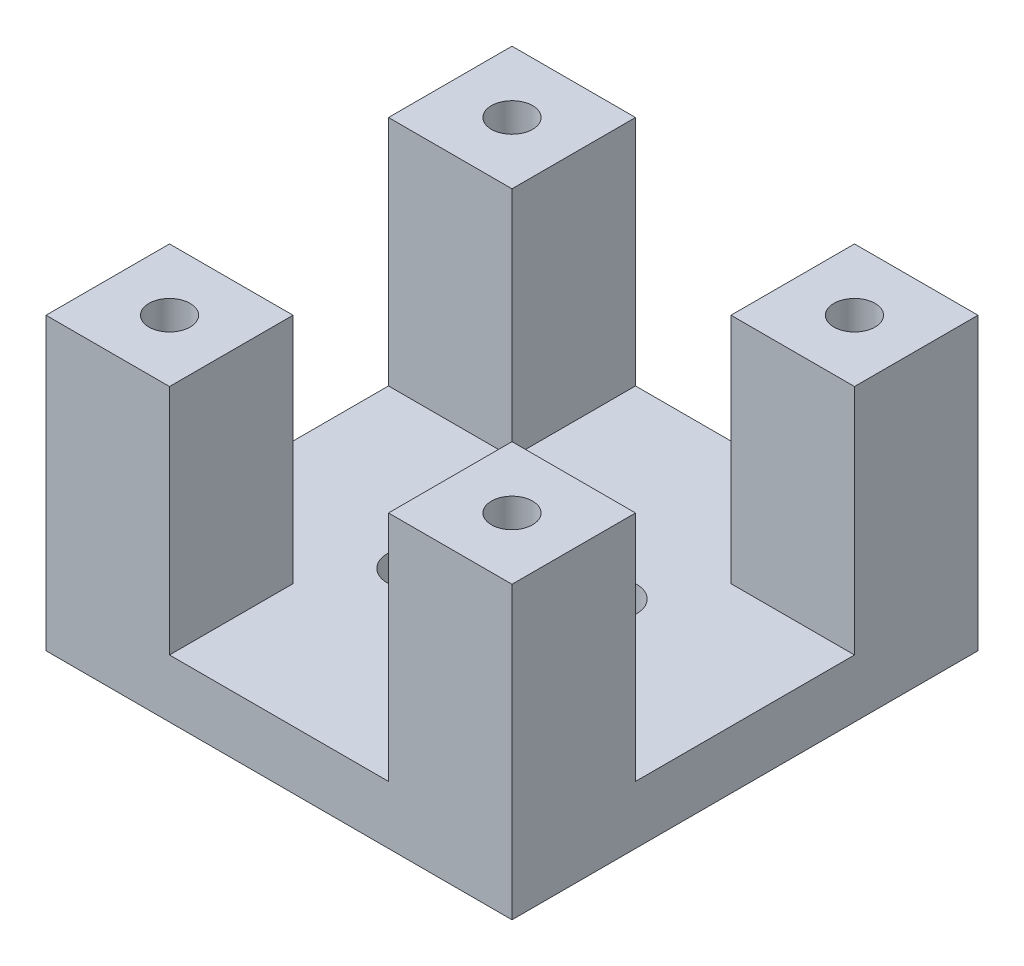
from build123d import *

# Parameters (mm, degrees)
SKETCH1_W           = 96.210678118
SKETCH1_H           = 96.210678118
SKETCH1_R           = 10
SKETCH1_R_2         = 3.25
SKETCH1_R_3         = 4.25
BOSS_EXTRUDE1_DEPTH = 60
CUT_EXTRUDE2_DEPTH  = 48
SKETCH2_R           = 5.25
CUT_EXTRUDE3_DEPTH  = 54


with BuildPart() as part:
    # Sketch1 → Boss-Extrude1 (new body)
    with BuildSketch(Plane(origin=(0, 0, 0), x_dir=(1, 0, 0), z_dir=(0, 1, 0))):
        Rectangle(SKETCH1_W, SKETCH1_H)
        with Locations(Location((0, 0, 0), (0, 0, 270))):
            Circle(SKETCH1_R, mode=Mode.SUBTRACT)
        with Locations(Location((0, 15, 0), (0, 0, 270))):
            Circle(SKETCH1_R_2, mode=Mode.SUBTRACT)
        with Locations(Location((35.355339059, 35.355339059, 0), (0, 0, 270))):
            Circle(SKETCH1_R_3, mode=Mode.SUBTRACT)
        with Locations(Location((12.990381057, 7.5, 0), (0, 0, 270))):
            Circle(SKETCH1_R_2, mode=Mode.SUBTRACT)
        with Locations(Location((12.990381057, -7.5, 0), (0, 0, 270))):
            Circle(SKETCH1_R_2, mode=Mode.SUBTRACT)
        with Locations(Location((0, -15, 0), (0, 0, 270))):
            Circle(SKETCH1_R_2, mode=Mode.SUBTRACT)
        with Locations(Location((-12.990381057, -7.5, 0), (0, 0, 270))):
            Circle(SKETCH1_R_2, mode=Mode.SUBTRACT)
        with Locations(Location((-12.990381057, 7.5, 0), (0, 0, 270))):
            Circle(SKETCH1_R_2, mode=Mode.SUBTRACT)
        with Locations(Location((35.355339059, -35.355339059, 0), (0, 0, 270))):
            Circle(SKETCH1_R_3, mode=Mode.SUBTRACT)
        with Locations(Location((-35.355339059, -35.355339059, 0), (0, 0, 270))):
            Circle(SKETCH1_R_3, mode=Mode.SUBTRACT)
        with Locations(Location((-35.355339059, 35.355339059, 0), (0, 0, 270))):
            Circle(SKETCH1_R_3, mode=Mode.SUBTRACT)
    extrude(amount=BOSS_EXTRUDE1_DEPTH)

    # Sketch4 → Cut-Extrude2 (cut)
    with BuildSketch(Plane(origin=(0, 60, 0), x_dir=(1, 0, 0), z_dir=(0, 1, 0))):
        Polygon((-22.605339059, 48.105339059), (22.605339059, 48.105339059), (22.605339059, 22.605339059), (48.105339059, 22.605339059), (48.105339059, -22.605339059), (22.605339059, -22.605339059), (22.605339059, -48.105339059), (-22.605339059, -48.105339059), (-22.605339059, -22.605339059), (-48.105339059, -22.605339059), (-48.105339059, 22.605339059), (-22.605339059, 22.605339059), align=None)
    extrude(amount=-CUT_EXTRUDE2_DEPTH, mode=Mode.SUBTRACT)

    # Sketch2 → Cut-Extrude3 (cut)
    with BuildSketch(Plane(origin=(0, 60, 0), x_dir=(1, 0, 0), z_dir=(0, 1, 0))):
        with Locations((-12.990381057, 7.5)):
            Circle(SKETCH2_R)
        with Locations((0, 15)):
            Circle(SKETCH2_R)
        with Locations((12.990381057, 7.5)):
            Circle(SKETCH2_R)
        with Locations((12.990381057, -7.5)):
            Circle(SKETCH2_R)
        with Locations((0, -15)):
            Circle(SKETCH2_R)
        with Locations((-12.990381057, -7.5)):
            Circle(SKETCH2_R)
    extrude(amount=-CUT_EXTRUDE3_DEPTH, mode=Mode.SUBTRACT)


solid = part.part
